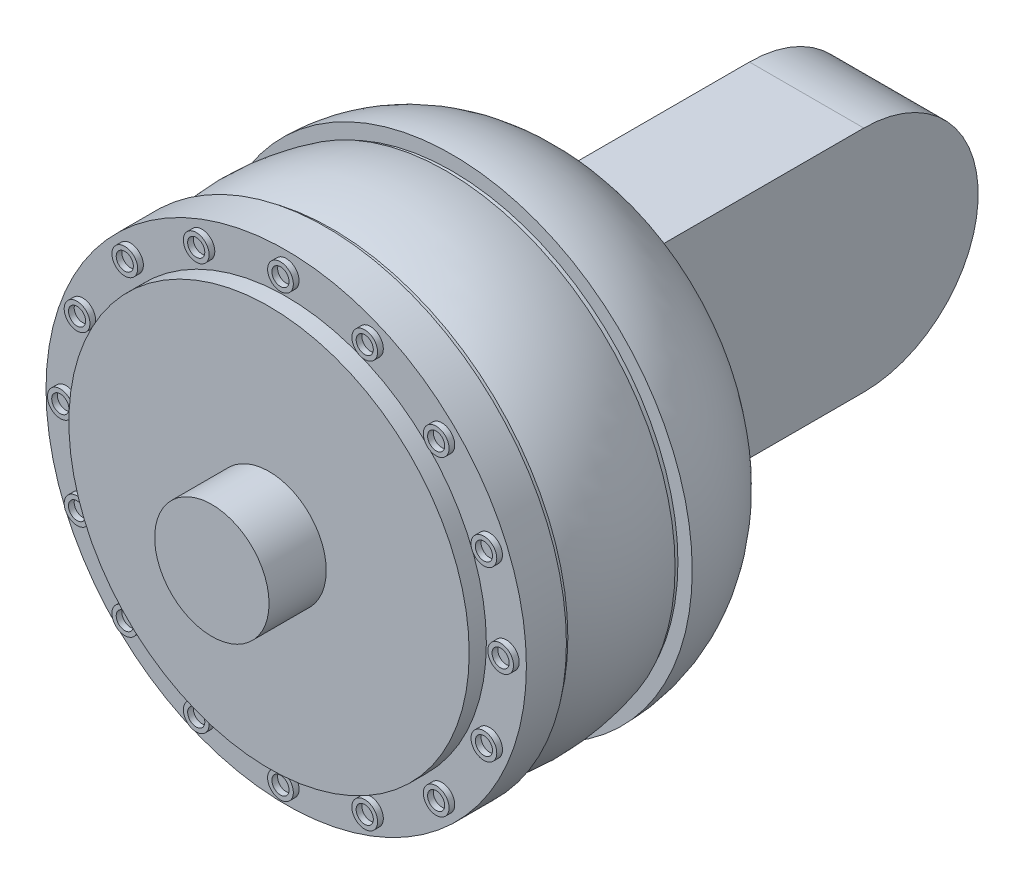
from build123d import *

# Parameters (mm, degrees)
SKETCH2_R           = 39.5
BOSS_EXTRUDE1_DEPTH = 1
SKETCH4_R           = 41.25
BOSS_EXTRUDE2_DEPTH = 1
SKETCH5_R           = 42
BOSS_EXTRUDE3_DEPTH = 7
SKETCH6_R           = 35
BOSS_EXTRUDE4_DEPTH = 3
SKETCH7_R           = 2.25
SKETCH7_R_2         = 1.5
BOSS_EXTRUDE5_DEPTH = 1
CIRPATTERN1_COUNT   = 16
SKETCH8_W           = 20
SKETCH8_H           = 40
BOSS_EXTRUDE6_DEPTH = 42
SKETCH10_R          = 20
BOSS_EXTRUDE7_DEPTH = 20
SKETCH11_R          = 10
BOSS_EXTRUDE8_DEPTH = 10
SKETCH12_R          = 10
BOSS_EXTRUDE9_DEPTH = 10


with BuildPart() as part:
    # Sketch1 → Revolve1 (revolve)
    with BuildSketch(Plane(origin=(0, 0, 0), x_dir=(1, 0, 0), z_dir=(0, 1, 0))):
        with BuildLine():
            Line((0, 0), (0, -20))
            Line((0, -20), (-42, -20))
            ThreePointArc((-42, -20), (-39.360679775, -8.819660113), (-32, 0))
            Line((-32, 0), (0, 0))
        make_face()
    revolve(axis=Axis((0, 0, 0), (0, 0, 1)))

    # Sketch2 → Boss-Extrude1 (add)
    with BuildSketch(Plane.XY.offset(20)):
        Circle(SKETCH2_R)
    extrude(amount=BOSS_EXTRUDE1_DEPTH)

    # Sketch3 → Revolve2 (revolve)
    with BuildSketch(Plane(origin=(0, 0, 0), x_dir=(1, 0, 0), z_dir=(0, 1, 0))):
        with BuildLine():
            Line((0, -21), (-40, -21))
            ThreePointArc((-40, -21), (-41.378719009, -30.999759684), (-40.003490497, -41))
            Line((-40.003490497, -41), (0, -41))
            Line((0, -41), (0, -21))
        make_face()
    revolve(axis=Axis((0, 0, 21), (0, 0, 1)))

    # Sketch4 → Boss-Extrude2 (add)
    with BuildSketch(Plane.XY.offset(41)):
        Circle(SKETCH4_R)
    extrude(amount=BOSS_EXTRUDE2_DEPTH)

    # Sketch5 → Boss-Extrude3 (add)
    with BuildSketch(Plane.XY.offset(42)):
        Circle(SKETCH5_R)
    extrude(amount=BOSS_EXTRUDE3_DEPTH)

    # Sketch6 → Boss-Extrude4 (add)
    with BuildSketch(Plane.XY.offset(49)):
        Circle(SKETCH6_R)
    extrude(amount=BOSS_EXTRUDE4_DEPTH)

    # Sketch7 → Boss-Extrude5 (add)
    with BuildSketch(Plane.XY.offset(49)):
        with Locations((38.5, 0)):
            Circle(SKETCH7_R)
        with Locations((38.5, 0)):
            Circle(SKETCH7_R_2, mode=Mode.SUBTRACT)
    boss_extrude5 = extrude(amount=BOSS_EXTRUDE5_DEPTH)

    # CirPattern1: Boss-Extrude5 ×16 about axis
    cirpattern1_axis = Axis((0, 0, 0), (0, 0, 1))
    for i in range(1, CIRPATTERN1_COUNT):
        add(boss_extrude5.rotate(cirpattern1_axis, i * 360 / CIRPATTERN1_COUNT))

    # Sketch8 → Boss-Extrude6 (add)
    with BuildSketch(Plane(origin=(0, 0, 0), x_dir=(-1, 0, 0), z_dir=(0, 0, -1))):
        Rectangle(SKETCH8_W, SKETCH8_H)
    extrude(amount=BOSS_EXTRUDE6_DEPTH)

    # Sketch10 → Boss-Extrude7 (add)
    with BuildSketch(Plane.ZY.offset(10)):
        with Locations((-42, 0)):
            Circle(SKETCH10_R)
    extrude(amount=-BOSS_EXTRUDE7_DEPTH)

    # Sketch11 → Boss-Extrude8 (add)
    with BuildSketch(Plane.ZY.offset(10)):
        with Locations(Location((-42, 0, 0), (0, 0, 90))):
            Circle(SKETCH11_R)
    extrude(amount=BOSS_EXTRUDE8_DEPTH)

    # Sketch12 → Boss-Extrude9 (add)
    with BuildSketch(Plane.XY.offset(52)):
        Circle(SKETCH12_R)
    extrude(amount=BOSS_EXTRUDE9_DEPTH)


solid = part.part
